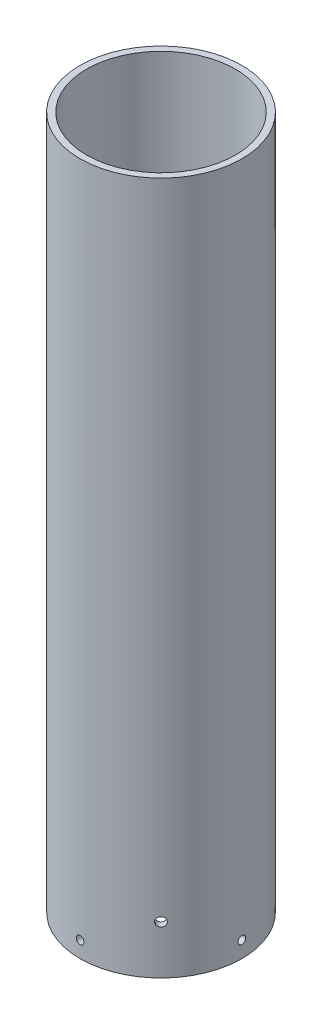
from build123d import *

# Parameters (mm, degrees)
SKETCH_1_R               = 25
SKETCH_1_R_2             = 23
EXTRUDE_1_DEPTH          = 214
SKETCH_5_R               = 1.2
CUT_EXTRUDE_5_DEPTH      = 217.90089903
PATTERN_CIRCULAR_1_COUNT = 4
SKETCH_6_R               = 1.4
CUT_EXTRUDE_6_DEPTH      = 217.900899153
PATTERN_CIRCULAR_2_COUNT = 4


with BuildPart() as part:
    # Эскиз1 → Бобышка-Вытянуть1 (new body)
    with BuildSketch(Plane(origin=(0, 0, 0), x_dir=(1, 0, 0), z_dir=(0, 1, 0))):
        with Locations(Location((0, 0, 0), (0, 0, 270))):
            Circle(SKETCH_1_R)
        with Locations(Location((0, 0, 0), (0, 0, 270))):
            Circle(SKETCH_1_R_2, mode=Mode.SUBTRACT)
    extrude(amount=EXTRUDE_1_DEPTH)

    # Эскиз5 → Вырез-Вытянуть5 (cut, through all)
    with BuildSketch(Plane.XY):
        with Locations(Location((0, 5, 0), (0, 0, 90))):
            Circle(SKETCH_5_R)
    cut_extrude_5 = extrude(amount=-CUT_EXTRUDE_5_DEPTH, mode=Mode.SUBTRACT)

    # Круговой массив1: Вырез-Вытянуть5 ×4 about axis
    pattern_circular_1_axis = Axis((0, 214, 0), (0, -1, 0))
    for i in range(1, PATTERN_CIRCULAR_1_COUNT):
        add(cut_extrude_5.rotate(pattern_circular_1_axis, i * 360 / PATTERN_CIRCULAR_1_COUNT), mode=Mode.SUBTRACT)

    # Эскиз6 → Вырез-Вытянуть6 (cut, through all)
    with BuildSketch(Plane(origin=(0, 0, 0), x_dir=(0, -1, 0), z_dir=(-0.7071067811865488, 0, 0.7071067811865464))):
        with Locations(Location((-15, 0, 0), (0, 0, 90))):
            Circle(SKETCH_6_R)
    cut_extrude_6 = extrude(amount=-CUT_EXTRUDE_6_DEPTH, mode=Mode.SUBTRACT)

    # Круговой массив2: Вырез-Вытянуть6 ×4 about axis
    pattern_circular_2_axis = Axis((0, 214, 0), (0, -1, 0))
    for i in range(1, PATTERN_CIRCULAR_2_COUNT):
        add(cut_extrude_6.rotate(pattern_circular_2_axis, i * 360 / PATTERN_CIRCULAR_2_COUNT), mode=Mode.SUBTRACT)


solid = part.part
